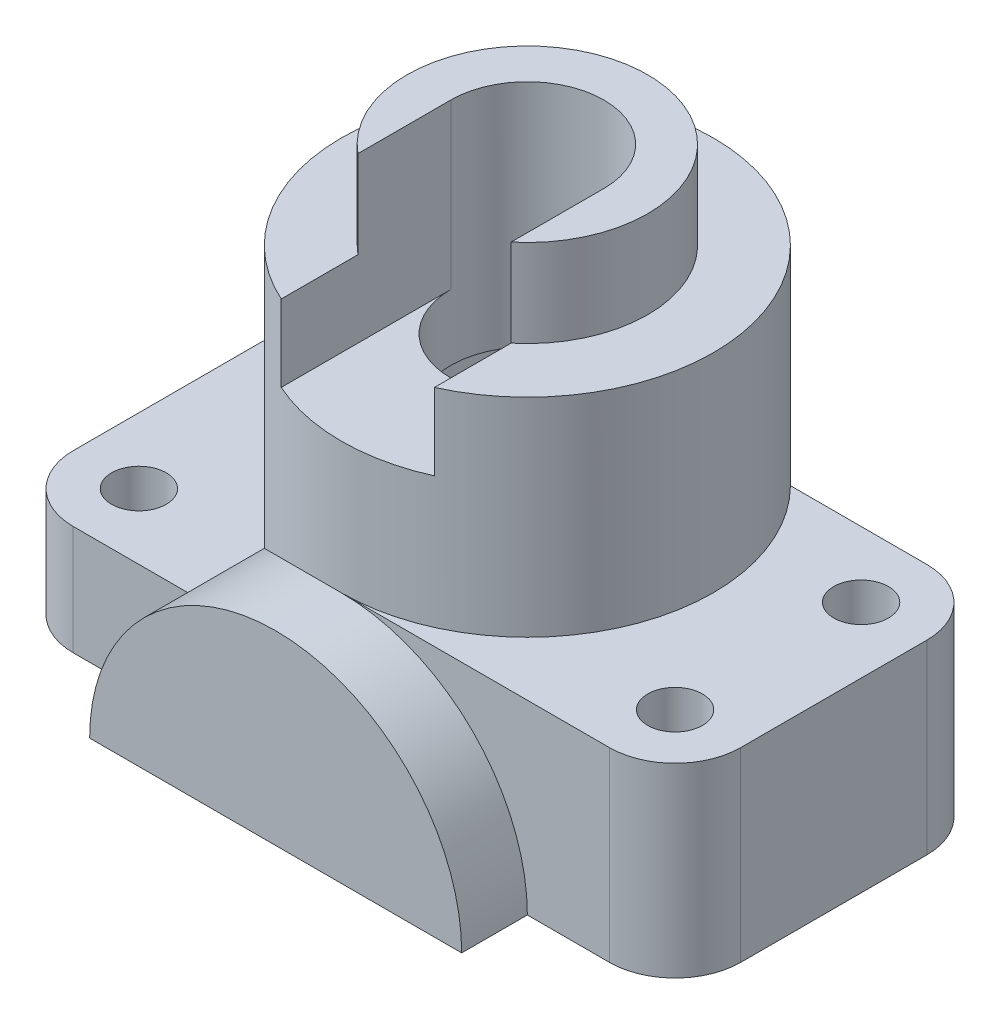
from build123d import *

# Parameters (mm, degrees)
SKETCH_2_R          = 17
EXTRUDE_1_DEPTH     = 36
EXTRUDE_3_REACH     = 52.14
SKETCH_4_R          = 11
SKETCH_5_R          = 7
CUT_EXTRUDE_1_DEPTH = 21
SKETCH_6_W          = 14
SKETCH_6_H          = 15
CUT_EXTRUDE_2_DEPTH = 21
EXTRUDE_5_DEPTH     = 23
SKETCH_8_R          = 2.5
EXTRUDE_6_DEPTH     = 17
SKETCH_9_R          = 2.5
EXTRUDE_7_DEPTH     = 10
CUT_EXTRUDE_3_DEPTH = 23


with BuildPart() as part:
    # 草图2 → 凸台-拉伸1 (new body)
    with BuildSketch(Plane(origin=(0, 0, 0), x_dir=(1, 0, 0), z_dir=(0, 1, 0))):
        with Locations(Location((0, 0, 0), (0, 0, 270))):
            Circle(SKETCH_2_R)
    extrude(amount=EXTRUDE_1_DEPTH)

    # 草图4 → 凸台-拉伸3 (add, up to next)
    with BuildSketch(Plane(origin=(0, 44, 0), x_dir=(1, 0, 0), z_dir=(0, 1, 0)), mode=Mode.PRIVATE) as extrude_3_sk1:
        with Locations(Location((0, 0, 0), (0, 0, 270))):
            Circle(SKETCH_4_R)
    extrude_3_tool1 = extrude(extrude_3_sk1.sketch, amount=-EXTRUDE_3_REACH, mode=Mode.PRIVATE) - part.part
    add(extrude_3_tool1.solids().sort_by_distance((0, 44, 0))[0])

    # 草图5 → 切除-拉伸1 (cut)
    with BuildSketch(Plane(origin=(0, 44, 0), x_dir=(1, 0, 0), z_dir=(0, 1, 0))):
        with Locations(Location((0, 0, 0), (0, 0, 270))):
            Circle(SKETCH_5_R)
    extrude(amount=-CUT_EXTRUDE_1_DEPTH, mode=Mode.SUBTRACT)

    # 草图6 → 切除-拉伸2 (cut)
    with BuildSketch(Plane.XY):
        with Locations((0, 36.5)):
            Rectangle(SKETCH_6_W, SKETCH_6_H)
    extrude(amount=CUT_EXTRUDE_2_DEPTH, mode=Mode.SUBTRACT)

    # 草图7 → 凸台-拉伸5 (add)
    with BuildSketch(Plane.XY.offset(23)):
        with BuildLine():
            Line((-17, 0), (17, 0))
            ThreePointArc((17, 0), (0, 17), (-17, 0))
        make_face()
    extrude(amount=-EXTRUDE_5_DEPTH)

    # 草图8 → 凸台-拉伸6 (add)
    with BuildSketch(Plane(origin=(0, 0, 0), x_dir=(1, 0, 0), z_dir=(0, 1, 0))):
        with BuildLine():
            Line((0, 12), (0, -17))
            Line((0, -17), (24.5, -17))
            ThreePointArc((24.5, -17), (28.742640687, -15.242640687), (30.5, -11))
            Line((30.5, -11), (30.5, 6))
            ThreePointArc((30.5, 6), (28.742640687, 10.242640687), (24.5, 12))
            Line((24.5, 12), (0, 12))
        make_face()
        with Locations(Location((24.5, 6, 0), (0, 0, 270))):
            Circle(SKETCH_8_R, mode=Mode.SUBTRACT)
        with Locations(Location((24.5, -11, 0), (0, 0, 270))):
            Circle(SKETCH_8_R, mode=Mode.SUBTRACT)
    extrude(amount=EXTRUDE_6_DEPTH)

    # 草图9 → 凸台-拉伸7 (add)
    with BuildSketch(Plane(origin=(0, 0, 0), x_dir=(1, 0, 0), z_dir=(0, 1, 0))):
        with BuildLine():
            Line((0, 12), (0, -17))
            Line((0, -17), (-24.5, -17))
            ThreePointArc((-24.5, -17), (-28.742640687, -15.242640687), (-30.5, -11))
            Line((-30.5, -11), (-30.5, 6))
            ThreePointArc((-30.5, 6), (-28.742640687, 10.242640687), (-24.5, 12))
            Line((-24.5, 12), (0, 12))
        make_face()
        with Locations(Location((-24.5, 6, 0), (0, 0, 270))):
            Circle(SKETCH_9_R, mode=Mode.SUBTRACT)
        with Locations(Location((-24.5, -11, 0), (0, 0, 270))):
            Circle(SKETCH_9_R, mode=Mode.SUBTRACT)
    extrude(amount=EXTRUDE_7_DEPTH)

    # 草图10 → 切除-拉伸3 (cut)
    with BuildSketch(Plane(origin=(0, 0, 0), x_dir=(1, 0, 0), z_dir=(0, 1, 0))):
        with BuildLine():
            Line((-12.041594579, 12), (-12.041594579, 0))
            ThreePointArc((-12.041594579, 0), (0, -12.041594579), (12.041594579, 0))
            Line((12.041594579, 0), (12.041594579, 12))
            ThreePointArc((12.041594579, 12), (0, 17), (-12.041594579, 12))
        make_face()
    extrude(amount=CUT_EXTRUDE_3_DEPTH, mode=Mode.SUBTRACT)


solid = part.part
